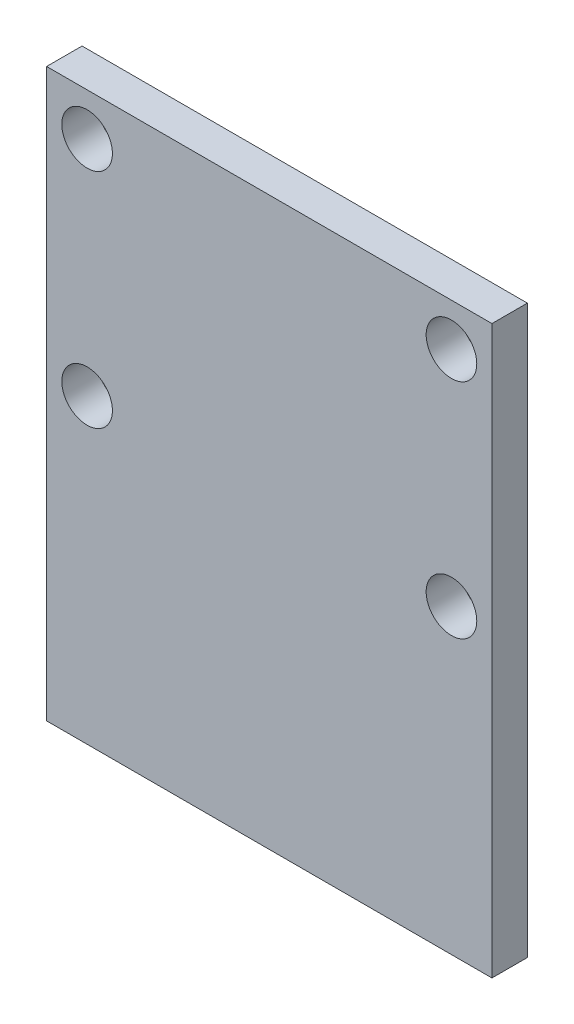
from build123d import *

# Parameters (mm, degrees)
SKETCH1_W           = 22
SKETCH1_H           = 28
SKETCH1_R           = 1.25
BOSS_EXTRUDE1_DEPTH = 1.75
SKETCH2_R           = 1
BOSS_EXTRUDE2_DEPTH = 1.25


with BuildPart() as part:
    # Sketch1 → Boss-Extrude1 (new body)
    with BuildSketch(Plane.XY):
        with Locations((11, 14)):
            Rectangle(SKETCH1_W, SKETCH1_H)
        with Locations((2, 25.9)):
            Circle(SKETCH1_R, mode=Mode.SUBTRACT)
        with Locations((2, 14.9)):
            Circle(SKETCH1_R, mode=Mode.SUBTRACT)
        with Locations((20, 14.9)):
            Circle(SKETCH1_R, mode=Mode.SUBTRACT)
        with Locations((20, 25.9)):
            Circle(SKETCH1_R, mode=Mode.SUBTRACT)
    extrude(amount=BOSS_EXTRUDE1_DEPTH)

    # Sketch2 → Boss-Extrude2 (add)
    with BuildSketch(Plane(origin=(0, 0, 0), x_dir=(-1, 0, 0), z_dir=(0, 0, -1))):
        with Locations(Location((-11, 20.4, 0), (0, 0, 180))):
            Circle(SKETCH2_R)
    extrude(amount=BOSS_EXTRUDE2_DEPTH)


solid = part.part
